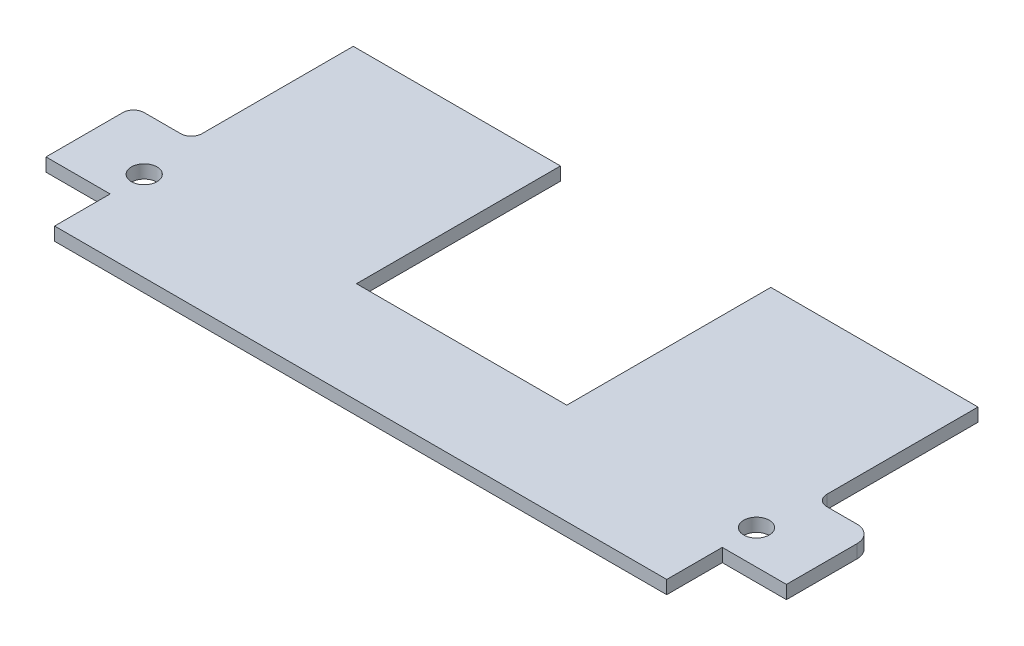
from build123d import *

# Parameters (mm, degrees)
SKETCH1_R           = 1.524000008
SKETCH1_R_2         = 1.523999992
BOSS_EXTRUDE1_DEPTH = 1.575


with BuildPart() as part:
    # Sketch1 → Boss-Extrude1 (new body)
    with BuildSketch(Plane(origin=(0, 0, 0), x_dir=(1, 0, 0), z_dir=(0, 1, 0))):
        with BuildLine():
            Line((44.351293307, -40.014412246), (36.727293315, -40.014412246))
            Line((36.727293315, -40.014412246), (36.727293315, -46.615946892))
            Line((36.727293315, -46.615946892), (30.377293307, -46.615946892))
            Line((30.377293307, -46.615946892), (-29.674706693, -46.615946892))
            Line((-29.674706693, -46.615946892), (-36.024706701, -46.615946892))
            Line((-36.024706701, -46.615946892), (-36.024706701, -40.014412246))
            Line((-36.024706701, -40.014412246), (-43.648706693, -40.014412246))
            Line((-43.648706693, -40.014412246), (-43.648706693, -30.885946892))
            ThreePointArc((-43.648706693, -30.885946892), (-43.276732305, -29.98792128), (-42.378706693, -29.615946892))
            Line((-42.378706693, -29.615946892), (-38.043706693, -29.615946892))
            ThreePointArc((-38.043706693, -29.615946892), (-37.145681081, -29.243972504), (-36.773706693, -28.345946892))
            Line((-36.773706693, -28.345946892), (-36.773706693, -10.370428445))
            Line((-36.773706693, -10.370428445), (-12.148706693, -10.370428445))
            Line((-12.148706693, -10.370428445), (-12.148706693, -17.871301308))
            Line((-12.148706693, -17.871301308), (-12.148706693, -34.615947016))
            Line((-12.148706693, -34.615947016), (12.851293307, -34.615947016))
            Line((12.851293307, -34.615947016), (12.851293307, -17.871301308))
            Line((12.851293307, -17.871301308), (12.851293307, -10.370428445))
            Line((12.851293307, -10.370428445), (37.476293307, -10.370428445))
            Line((37.476293307, -10.370428445), (37.476293307, -28.345946892))
            ThreePointArc((37.476293307, -28.345946892), (37.848267695, -29.243972504), (38.746293307, -29.615946892))
            Line((38.746293307, -29.615946892), (42.351293307, -29.615946892))
            ThreePointArc((42.351293307, -29.615946892), (43.76550687, -30.20173333), (44.351293307, -31.615946892))
            Line((44.351293307, -31.615946892), (44.351293307, -40.014412246))
        make_face()
        with Locations(Location((-36.024706701, -35.965946892, 0), (0, 0, 270))):
            Circle(SKETCH1_R, mode=Mode.SUBTRACT)
        with Locations(Location((36.727293315, -35.947946892, 0), (0, 0, 270))):
            Circle(SKETCH1_R_2, mode=Mode.SUBTRACT)
    extrude(amount=BOSS_EXTRUDE1_DEPTH)


solid = part.part
